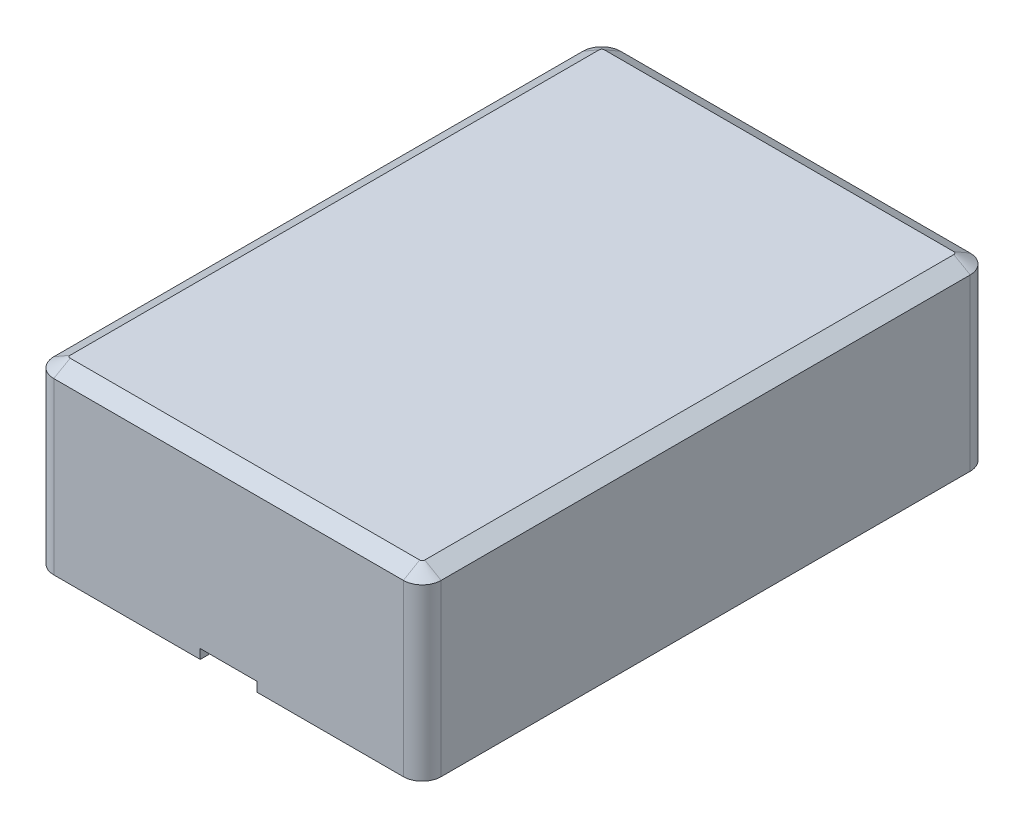
from build123d import *
from OCP.BRepFilletAPI import BRepFilletAPI_MakeChamfer

# Parameters (mm, degrees)
SKETCH_1_W               = 41
SKETCH_1_H               = 60
EXTRUDE_1_DEPTH          = 3
SKETCH_2_W               = 41
SKETCH_2_H               = 60
SKETCH_2_W_2             = 38
SKETCH_2_H_2             = 57
EXTRUDE_1_2_DEPTH        = 17
SKETCH_3_W               = 27
SKETCH_3_H               = 3.030341357
CUT_EXTRUDE_1_DEPTH      = 17
SKETCH_4_R               = 2.5
EXTRUDE_2_DEPTH          = 17
CUT_EXTRUDE_2_DEPTH      = 42.475896615
CUT_EXTRUDE_2_DEPTH_BACK = 42.475896615
SKETCH_5_R               = 1.5
SKETCH_9_W               = 41
SKETCH_9_H               = 3
CUT_EXTRUDE_3_DEPTH      = 67.484960705
SKETCH_10_W              = 41
SKETCH_10_H              = 60
EXTRUDE_4_DEPTH          = 2
SKETCH_11_W              = 6
SKETCH_11_H              = 3.013062302
CUT_EXTRUDE_4_DEPTH      = 1
SKETCH_12_W              = 14
SKETCH_12_H              = 6
EXTRUDE_6_DEPTH          = 5
FILLET_2_R               = 1
FILLET_3_R               = 1
FILLET_4_R               = 2
CHAMFER_2_SIZE           = 1
CHAMFER_2_SIZE2          = 1.732050808


with BuildPart() as part:
    # Эскиз1 → Extrude 1 (new body)
    with BuildSketch(Plane(origin=(0, 0, 0), x_dir=(1, 0, 0), z_dir=(0, 1, 0))):
        Rectangle(SKETCH_1_W, SKETCH_1_H)
    extrude(amount=EXTRUDE_1_DEPTH)

    # Эскиз2 → Extrude 1 2 (add)
    with BuildSketch(Plane(origin=(0, 3, 0), x_dir=(1, 0, 0), z_dir=(0, 1, 0))):
        Rectangle(SKETCH_2_W, SKETCH_2_H)
        Rectangle(SKETCH_2_W_2, SKETCH_2_H_2, mode=Mode.SUBTRACT)
    extrude(amount=EXTRUDE_1_2_DEPTH)

    # Эскиз3 → Вырез-Вытянуть1 (cut)
    with BuildSketch(Plane(origin=(0, 20, 0), x_dir=(1, 0, 0), z_dir=(0, 1, 0))):
        with Locations((0, 29.478101209)):
            Rectangle(SKETCH_3_W, SKETCH_3_H)
    extrude(amount=-CUT_EXTRUDE_1_DEPTH, mode=Mode.SUBTRACT)

    # Эскиз4 → Бобышка-Вытянуть2 (add)
    with BuildSketch(Plane(origin=(0, 3, 0), x_dir=(1, 0, 0), z_dir=(0, 1, 0))):
        with Locations((17, 25)):
            Circle(SKETCH_4_R)
        with Locations((-17, 25)):
            Circle(SKETCH_4_R)
        with Locations((17, -25)):
            Circle(SKETCH_4_R)
        with Locations((-17, -25)):
            Circle(SKETCH_4_R)
    extrude(amount=EXTRUDE_2_DEPTH)

    # Эскиз5 → Вырез-Вытянуть2 (cut, two sides: drawn at the far end of the back side and taken through both)
    with BuildSketch(Plane(origin=(0, 20, 0), x_dir=(1, 0, 0), z_dir=(0, 1, 0)).offset(-CUT_EXTRUDE_2_DEPTH_BACK)):
        with Locations(Location((17, 25, 0), (0, 0, 270))):
            Circle(SKETCH_5_R)
        with Locations(Location((17, -25, 0), (0, 0, 270))):
            Circle(SKETCH_5_R)
        with Locations(Location((-17, -25, 0), (0, 0, 270))):
            Circle(SKETCH_5_R)
        with Locations(Location((-17, 25, 0), (0, 0, 270))):
            Circle(SKETCH_5_R)
    extrude(amount=CUT_EXTRUDE_2_DEPTH + CUT_EXTRUDE_2_DEPTH_BACK, mode=Mode.SUBTRACT)

    # Эскиз9 → Вырез-Вытянуть3 (cut, through all)
    with BuildSketch(Plane(origin=(0, 0, -30), x_dir=(-1, 0, 0), z_dir=(0, 0, -1))):
        with Locations((0, 1.5)):
            Rectangle(SKETCH_9_W, SKETCH_9_H)
    extrude(amount=-CUT_EXTRUDE_3_DEPTH, mode=Mode.SUBTRACT)

    # Эскиз10 → Бобышка-Вытянуть4 (add)
    with BuildSketch(Plane(origin=(0, 20, 0), x_dir=(1, 0, 0), z_dir=(0, 1, 0))):
        Rectangle(SKETCH_10_W, SKETCH_10_H)
    extrude(amount=EXTRUDE_4_DEPTH)

    # Эскиз11 → Вырез-Вытянуть4 (cut)
    with BuildSketch(Plane.XZ.offset(-3)):
        with Locations((0, 29.353335514)):
            Rectangle(SKETCH_11_W, SKETCH_11_H)
    extrude(amount=-CUT_EXTRUDE_4_DEPTH, mode=Mode.SUBTRACT)

    # Эскиз12 → Бобышка-Вытянуть6 (add)
    with BuildSketch(Plane.XZ.offset(-20)):
        with Locations((12, 20.5)):
            Rectangle(SKETCH_12_W, SKETCH_12_H)
    extrude(amount=EXTRUDE_6_DEPTH)

    # Скругление2
    fillet_2_edges = [part.edges().sort_by_distance(p)[0] for p in [
        (12, 15, 17.5),
        (5, 17.5, 17.5),
    ]]
    fillet(fillet_2_edges, radius=FILLET_2_R)

    # Скругление3
    fillet_3_edges = [part.edges().sort_by_distance(p)[0] for p in [
        (0, 4, 28.5),
    ]]
    fillet(fillet_3_edges, radius=FILLET_3_R)

    # Скругление4
    fillet_4_edges = [part.edges().sort_by_distance(p)[0] for p in [
        (20.5, 12.5, 30),
        (-20.5, 12.5, 30),
        (-20.5, 12.5, -30),
        (20.5, 12.5, -30),
    ]]
    fillet(fillet_4_edges, radius=FILLET_4_R)

    # Фаска2: one chamfer whose edges measure the first distance from different faces: ONE call of the kernel's chamfer builder (chamfer() names one face for all edges)
    chamfer_2_edges_1 = [part.edges().sort_by_distance(p)[0] for p in [
        (20.5, 22, 0),
    ]]
    chamfer_2_side_1 = [part.faces().sort_by_distance(p)[0] for p in [
        (20.5, 12.5, 0),
    ]]
    chamfer_2_edges_2 = [part.edges().sort_by_distance(p)[0] for p in [
        (0, 22, 30),
    ]]
    chamfer_2_side_2 = [part.faces().sort_by_distance(p)[0] for p in [
        (0, 12.577474892, 30),
    ]]
    chamfer_2_edges_3 = [part.edges().sort_by_distance(p)[0] for p in [
        (-20.5, 22, 0),
    ]]
    chamfer_2_side_3 = [part.faces().sort_by_distance(p)[0] for p in [
        (-20.5, 12.5, 0),
    ]]
    chamfer_2_edges_4 = [part.edges().sort_by_distance(p)[0] for p in [
        (0, 22, -30),
    ]]
    chamfer_2_side_4 = [part.faces().sort_by_distance(p)[0] for p in [
        (-16, 3.415932687, -30),
    ]]
    chamfer_2_edges_5 = [part.edges().sort_by_distance(p)[0] for p in [
        (-19.914213562, 22, 29.414213562),
    ]]
    chamfer_2_side_5 = [part.faces().sort_by_distance(p)[0] for p in [
        (-19.914213562, 12.5, 29.414213562),
    ]]
    chamfer_2_edges_6 = [part.edges().sort_by_distance(p)[0] for p in [
        (-19.914213562, 22, -29.414213562),
    ]]
    chamfer_2_side_6 = [part.faces().sort_by_distance(p)[0] for p in [
        (-19.914213562, 12.5, -29.414213562),
    ]]
    chamfer_2_edges_7 = [part.edges().sort_by_distance(p)[0] for p in [
        (19.914213562, 22, -29.414213562),
    ]]
    chamfer_2_side_7 = [part.faces().sort_by_distance(p)[0] for p in [
        (19.914213562, 12.5, -29.414213562),
    ]]
    chamfer_2_edges_8 = [part.edges().sort_by_distance(p)[0] for p in [
        (19.914213562, 22, 29.414213562),
    ]]
    chamfer_2_side_8 = [part.faces().sort_by_distance(p)[0] for p in [
        (19.914213562, 12.5, 29.414213562),
    ]]
    chamfer_2 = BRepFilletAPI_MakeChamfer(part.part.solid().wrapped)
    for e in chamfer_2_edges_1:
        chamfer_2.Add(CHAMFER_2_SIZE, CHAMFER_2_SIZE2, e.wrapped, chamfer_2_side_1[0].wrapped)  # the first distance lies on this face
    for e in chamfer_2_edges_2:
        chamfer_2.Add(CHAMFER_2_SIZE, CHAMFER_2_SIZE2, e.wrapped, chamfer_2_side_2[0].wrapped)  # the first distance lies on this face
    for e in chamfer_2_edges_3:
        chamfer_2.Add(CHAMFER_2_SIZE, CHAMFER_2_SIZE2, e.wrapped, chamfer_2_side_3[0].wrapped)  # the first distance lies on this face
    for e in chamfer_2_edges_4:
        chamfer_2.Add(CHAMFER_2_SIZE, CHAMFER_2_SIZE2, e.wrapped, chamfer_2_side_4[0].wrapped)  # the first distance lies on this face
    for e in chamfer_2_edges_5:
        chamfer_2.Add(CHAMFER_2_SIZE, CHAMFER_2_SIZE2, e.wrapped, chamfer_2_side_5[0].wrapped)  # the first distance lies on this face
    for e in chamfer_2_edges_6:
        chamfer_2.Add(CHAMFER_2_SIZE, CHAMFER_2_SIZE2, e.wrapped, chamfer_2_side_6[0].wrapped)  # the first distance lies on this face
    for e in chamfer_2_edges_7:
        chamfer_2.Add(CHAMFER_2_SIZE, CHAMFER_2_SIZE2, e.wrapped, chamfer_2_side_7[0].wrapped)  # the first distance lies on this face
    for e in chamfer_2_edges_8:
        chamfer_2.Add(CHAMFER_2_SIZE, CHAMFER_2_SIZE2, e.wrapped, chamfer_2_side_8[0].wrapped)  # the first distance lies on this face
    add(Compound.cast(chamfer_2.Shape()), mode=Mode.REPLACE)


solid = part.part
